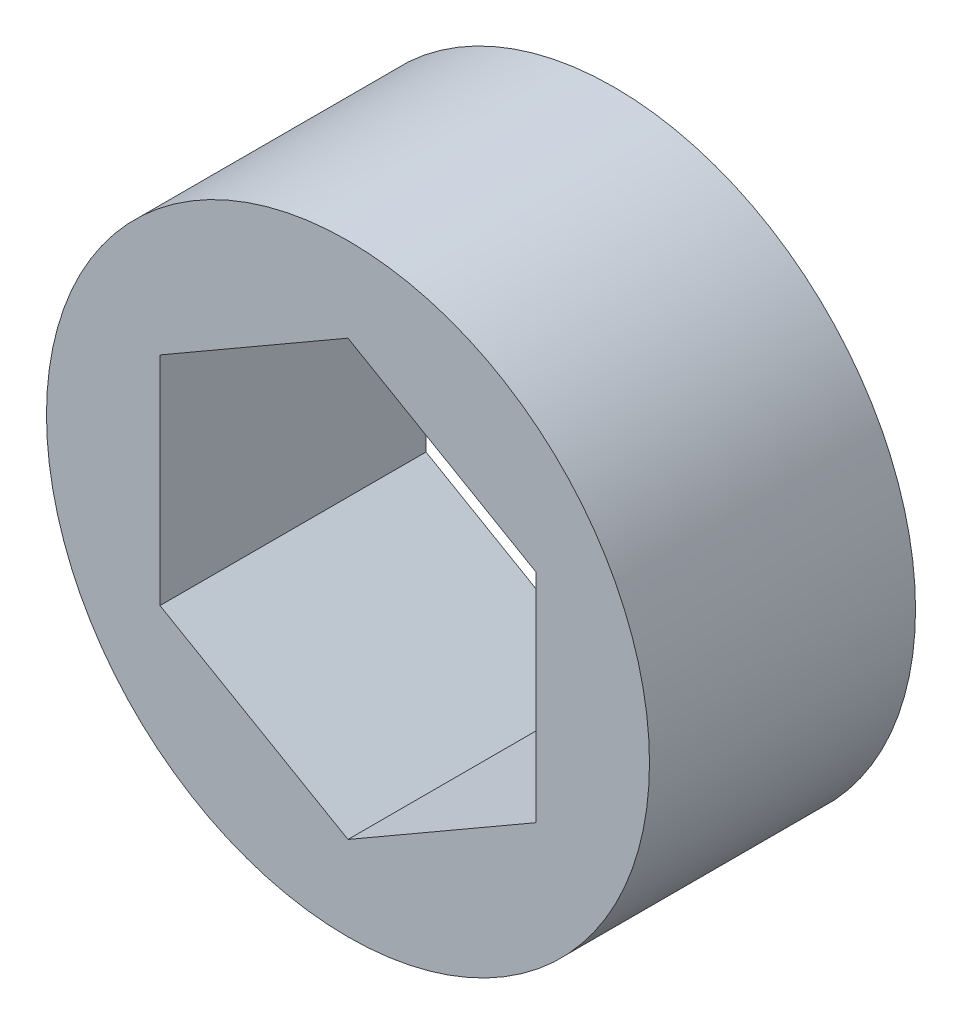
from build123d import *

# Parameters (mm, degrees)
SKETCH1_R           = 10.795
BOSS_EXTRUDE1_DEPTH = 9.525


with BuildPart() as part:
    # Sketch1 → Boss-Extrude1 (new body)
    with BuildSketch(Plane.XY):
        Circle(SKETCH1_R)
        Polygon((6.731, 3.886144662), (0, 7.772289324), (-6.731, 3.886144662), (-6.731, -3.886144662), (0, -7.772289324), (6.731, -3.886144662), align=None, mode=Mode.SUBTRACT)
    extrude(amount=BOSS_EXTRUDE1_DEPTH)


solid = part.part
